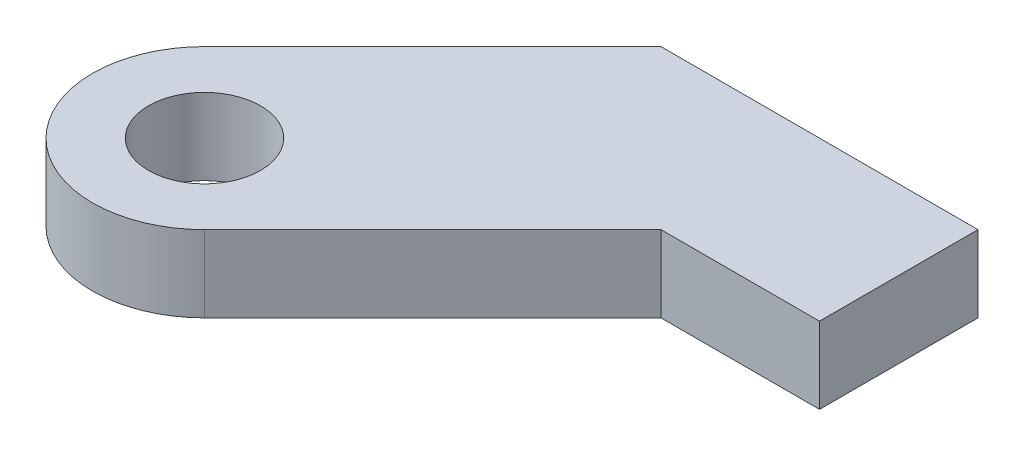
from build123d import *

# Parameters (mm, degrees)
SKETCH_2_R      = 1.1
EXTRUDE_1_DEPTH = 1.5


with BuildPart() as part:
    # 草图2 → 凸台-拉伸1 (new body)
    with BuildSketch(Plane(origin=(0, 0, 0), x_dir=(1, 0, 0), z_dir=(0, 1, 0))):
        with BuildLine():
            Line((1.537957249, 1.537957249), (4.649227086, 1.537957249))
            Line((4.649227086, 1.537957249), (4.649227086, -1.573312588))
            Line((4.649227086, -1.573312588), (1.537957249, -1.573312588))
            Line((1.537957249, -1.573312588), (-2.94156421, -6.052834047))
            ThreePointArc((-2.94156421, -6.052834047), (-6.052834047, -6.052834047), (-6.052834047, -2.94156421))
            Line((-6.052834047, -2.94156421), (-1.573312588, 1.537957249))
            Line((-1.573312588, 1.537957249), (1.537957249, 1.537957249))
        make_face()
        with Locations(Location((-4.497199128, -4.497199128, 0), (0, 0, 270))):
            Circle(SKETCH_2_R, mode=Mode.SUBTRACT)
    extrude(amount=EXTRUDE_1_DEPTH)


solid = part.part
